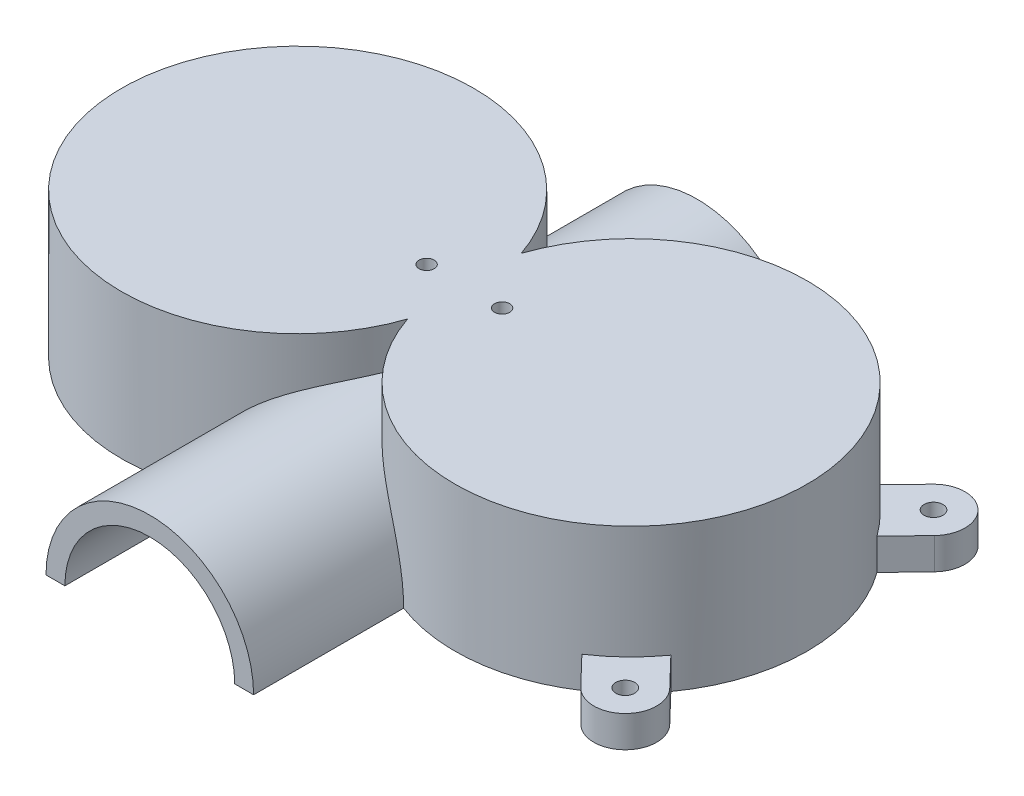
from build123d import *

# Parameters (mm, degrees)
BOSS_EXTRUDE1_DEPTH     = 23
SKETCH2_R               = 1.5
BOSS_EXTRUDE2_DEPTH     = 5
SKETCH3_R               = 1.5
BOSS_EXTRUDE3_DEPTH     = 5
BOSS_EXTRUDE4_DEPTH     = 37
BOSS_EXTRUDE5_START     = 50
BOSS_EXTRUDE5_DEPTH     = 50
CUT_EXTRUDE1_DEPTH      = 78.86002886
CUT_EXTRUDE1_DEPTH_BACK = 78.86002886
SKETCH5_R               = 25
CUT_EXTRUDE4_DEPTH      = 20
SKETCH7_R               = 1.2
CUT_EXTRUDE6_DEPTH      = 78.86002886


with BuildPart() as part:
    # Sketch1 → Boss-Extrude1 (new body)
    with BuildSketch(Plane(origin=(0, 0, 0), x_dir=(1, 0, 0), z_dir=(0, 1, 0))):
        with BuildLine():
            ThreePointArc((0, 9.04157066), (-54.5, 0), (0, -9.04157066))
            ThreePointArc((0, -9.04157066), (54.5, 0), (0, 9.04157066))
        make_face()
    extrude(amount=BOSS_EXTRUDE1_DEPTH)

    # Sketch2 → Boss-Extrude2 (add)
    with BuildSketch(Plane(origin=(0, 0, 0), x_dir=(1, 0, 0), z_dir=(0, 1, 0))):
        with BuildLine():
            Line((-33.5, 33), (-33.5, 27.110883423))
            ThreePointArc((-33.5, 27.110883423), (-28.532848636, 27.926108329), (-23.5, 27.838821814))
            Line((-23.5, 27.838821814), (-23.5, 33))
            ThreePointArc((-23.5, 33), (-28.5, 38), (-33.5, 33))
        make_face()
        with Locations((-28.5, 33)):
            Circle(SKETCH2_R, mode=Mode.SUBTRACT)
    extrude(amount=BOSS_EXTRUDE2_DEPTH)

    # Sketch3 → Boss-Extrude3 (add)
    # profile 1 of 2: a face of its own
    with BuildSketch(Plane(origin=(0, 0, 0), x_dir=(1, 0, 0), z_dir=(0, 1, 0))):
        with BuildLine():
            Line((41.999184876, -23.318989433), (46.471409292, -27.966816245))
            ThreePointArc((46.471409292, -27.966816245), (53.541166714, -28.102941176), (53.677291645, -21.033183755))
            Line((53.677291645, -21.033183755), (49.205067229, -16.385356942))
            ThreePointArc((49.205067229, -16.385356942), (45.914170974, -20.176470588), (41.999184876, -23.318989433))
        make_face()
        with Locations((50.074350468, -24.5)):
            Circle(SKETCH3_R, mode=Mode.SUBTRACT)
    # profile 2 of 2: a face of its own
    with BuildSketch(Plane(origin=(0, 0, 0), x_dir=(1, 0, 0), z_dir=(0, 1, 0))):
        with BuildLine():
            ThreePointArc((53.677291645, 21.033183755), (53.541166714, 28.102941176), (46.471409292, 27.966816245))
            Line((46.471409292, 27.966816245), (41.999184876, 23.318989433))
            ThreePointArc((41.999184876, 23.318989433), (45.914170974, 20.176470588), (49.205067229, 16.385356942))
            Line((49.205067229, 16.385356942), (53.677291645, 21.033183755))
        make_face()
        with Locations((50.074350468, 24.5)):
            Circle(SKETCH3_R, mode=Mode.SUBTRACT)
    extrude(amount=BOSS_EXTRUDE3_DEPTH)

    # Sketch6 → Boss-Extrude4 (add)
    with BuildSketch(Plane.XY):
        with BuildLine():
            Line((-16.5, 0), (16.5, 0))
            ThreePointArc((16.5, 0), (0, 16.5), (-16.5, 0))
        make_face()
    extrude(amount=-BOSS_EXTRUDE4_DEPTH)

    # Sketch6<2> → Boss-Extrude5 (add)
    with BuildSketch(Plane.XY.offset(BOSS_EXTRUDE5_START)):
        with BuildLine():
            Line((-16.5, 0), (16.5, 0))
            ThreePointArc((16.5, 0), (0, 16.5), (-16.5, 0))
        make_face()
    extrude(amount=-BOSS_EXTRUDE5_DEPTH)

    # Sketch4 → Cut-Extrude1 (cut, two sides: drawn at the far end of the back side and taken through both)
    with BuildSketch(Plane.XY.offset(-CUT_EXTRUDE1_DEPTH_BACK)):
        with BuildLine():
            Line((-13.5, 0), (13.5, 0))
            ThreePointArc((13.5, 0), (0, 13.5), (-13.5, 0))
        make_face()
    extrude(amount=CUT_EXTRUDE1_DEPTH + CUT_EXTRUDE1_DEPTH_BACK, mode=Mode.SUBTRACT)

    # Sketch5 → Cut-Extrude4 (cut)
    with BuildSketch(Plane(origin=(0, 0, 0), x_dir=(1, 0, 0), z_dir=(0, 1, 0))):
        with Locations((-26.5, 0)):
            Circle(SKETCH5_R)
        with Locations((26.5, 0)):
            Circle(SKETCH5_R)
    extrude(amount=CUT_EXTRUDE4_DEPTH, mode=Mode.SUBTRACT)

    # Sketch7 → Cut-Extrude6 (cut, through all)
    with BuildSketch(Plane(origin=(0, 0, 0), x_dir=(1, 0, 0), z_dir=(0, 1, 0))):
        with Locations((-6, 0)):
            Circle(SKETCH7_R)
        with Locations((6, 0)):
            Circle(SKETCH7_R)
    extrude(amount=CUT_EXTRUDE6_DEPTH, mode=Mode.SUBTRACT)


solid = part.part
